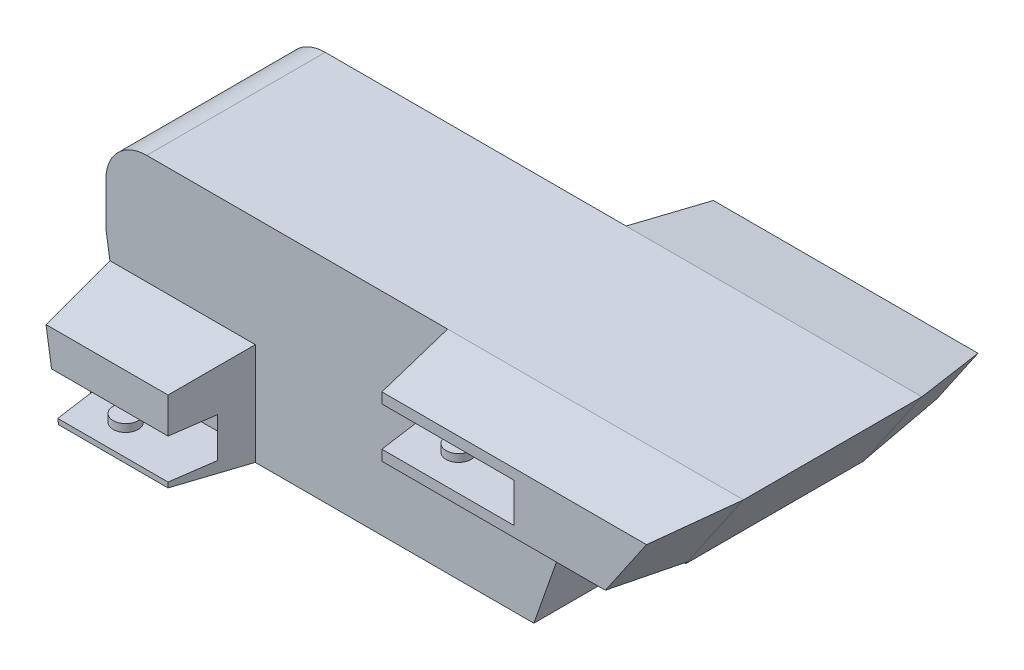
from build123d import *

# Parameters (mm, degrees)
SALIENTE_EXTRUIR1_DEPTH           = 35
SALIENTE_EXTRUIR2_DEPTH           = 15
SALIENTE_EXTRUIR2_DRAFT           = 8
SALIENTE_EXTRUIR2_PROFILE_2_DEPTH = 15
SALIENTE_EXTRUIR2_PROFILE_2_DRAFT = 8
SIMETR_A1_COPY_1_DEPTH            = 15
SIMETR_A1_COPY_1_DRAFT            = 8
SIMETR_A1_COPY_2_DEPTH            = 15
SIMETR_A1_COPY_2_DRAFT            = 8
SIMETR_A1_COPY_3_DEPTH            = 15
SIMETR_A1_COPY_3_DRAFT            = 8
CROQUIS6_W                        = 28.054373897
CROQUIS6_H                        = 7.683774959
CORTAR_EXTRUIR2_DEPTH             = 13.5
CROQUIS8_R                        = 2.45
SALIENTE_EXTRUIR3_DEPTH           = 1.5
CROQUIS9_R                        = 2.45
SALIENTE_EXTRUIR4_DEPTH           = 1.5
CROQUIS10_R                       = 2.45
SALIENTE_EXTRUIR5_DEPTH           = 1.5
SALIENTE_EXTRUIR6_START           = 1.5
CROQUIS13_R                       = 2.45
SALIENTE_EXTRUIR6_DEPTH           = 1.5


with BuildPart() as part:
    # Croquis2 → Saliente-Extruir1 (new body)
    with BuildSketch(Plane.XY):
        with BuildLine():
            Line((30.877885102, -17.110048254), (39.667083018, 7.889951746))
            Line((39.667083018, 7.889951746), (60.667083018, 7.889951746))
            Line((60.667083018, 7.889951746), (71.969737573, 24.389951746))
            Line((71.969737573, 24.389951746), (-45.030262427, 24.389951746))
            ThreePointArc((-45.030262427, 24.389951746), (-50.687116676, 22.046805996), (-53.030262427, 16.389951746))
            Line((-53.030262427, 16.389951746), (-53.030262427, 7.889951746))
            Line((-53.030262427, 7.889951746), (-49.122114898, -17.110048254))
            Line((-49.122114898, -17.110048254), (30.877885102, -17.110048254))
        make_face()
    extrude(amount=SALIENTE_EXTRUIR1_DEPTH)


with BuildPart() as saliente_extruir2_tool:
    # Croquis5 → Saliente-Extruir2 (with draft: the straight prism first)
    with BuildSketch(Plane.XY.offset(35)):
        Polygon((-49.122114898, -17.110048254), (-23.748632921, -17.110048254), (-23.748632921, 2.889951746), (-52.248632921, 2.889951746), align=None)
    extrude(amount=SALIENTE_EXTRUIR2_DEPTH)
    # Saliente-Extruir2: the draft: its side faces are tilted about the plane it starts from
    saliente_extruir2_sides = [saliente_extruir2_tool.faces().sort_by_distance(p)[0] for p in [
        (-36.435373909, -17.110048254, 42.5),
        (-23.748632921, -7.110048254, 42.5),
        (-37.998632921, 2.889951746, 42.5),
        (-50.685373909, -7.110048254, 42.5),
    ]]
    draft(saliente_extruir2_sides, Plane.XY.offset(35), SALIENTE_EXTRUIR2_DRAFT)


with BuildPart() as part_1:
    add(part.part)

    # Saliente-Extruir2: add saliente_extruir2_tool
    add(saliente_extruir2_tool.part)


with BuildPart() as saliente_extruir2_profile_2_tool:
    # Croquis5 → Saliente-Extruir2 profile 2 (with draft: the straight prism first)
    with BuildSketch(Plane.XY.offset(35)):
        Polygon((71.969737573, 24.389951746), (13.969737573, 24.389951746), (13.969737573, 8.389951746), (61.009587702, 8.389951746), align=None)
    extrude(amount=SALIENTE_EXTRUIR2_PROFILE_2_DEPTH)
    # Saliente-Extruir2 profile 2: the draft: its side faces are tilted about the plane it starts from
    saliente_extruir2_profile_2_sides = [saliente_extruir2_profile_2_tool.faces().sort_by_distance(p)[0] for p in [
        (42.969737573, 24.389951746, 42.5),
        (13.969737573, 16.389951746, 42.5),
        (37.489662638, 8.389951746, 42.5),
        (66.489662638, 16.389951746, 42.5),
    ]]
    draft(saliente_extruir2_profile_2_sides, Plane.XY.offset(35), SALIENTE_EXTRUIR2_PROFILE_2_DRAFT)


with BuildPart() as part_2:
    add(part_1.part)

    # Saliente-Extruir2 profile 2: add saliente_extruir2_profile_2_tool
    add(saliente_extruir2_profile_2_tool.part)


with BuildPart() as simetr_a1_copy_1_tool:
    # Simetría1 copy 1 sketch → Simetría1 copy 1 (with draft: the straight prism first)
    with BuildSketch(Plane(origin=(0, 0, 0), x_dir=(1, 0, 0), z_dir=(0, 0, -1))):
        Polygon((-49.122114898, 17.110048254), (-23.748632921, 17.110048254), (-23.748632921, -2.889951746), (-52.248632921, -2.889951746), align=None)
    extrude(amount=SIMETR_A1_COPY_1_DEPTH)
    # Simetría1 copy 1: the draft: its side faces are tilted about the plane it starts from
    simetr_a1_copy_1_sides = [simetr_a1_copy_1_tool.faces().sort_by_distance(p)[0] for p in [
        (-36.435373909, -17.110048254, -7.5),
        (-23.748632921, -7.110048254, -7.5),
        (-37.998632921, 2.889951746, -7.5),
        (-50.685373909, -7.110048254, -7.5),
    ]]
    draft(simetr_a1_copy_1_sides, Plane(origin=(0, 0, 0), x_dir=(1, 0, 0), z_dir=(0, 0, -1)), SIMETR_A1_COPY_1_DRAFT)


with BuildPart() as part_3:
    add(part_2.part)

    # Simetría1 copy 1: add simetr_a1_copy_1_tool
    add(simetr_a1_copy_1_tool.part)


with BuildPart() as simetr_a1_copy_2_tool:
    # Simetría1 copy 2 sketch → Simetría1 copy 2 (with draft: the straight prism first)
    with BuildSketch(Plane(origin=(0, 0, 0), x_dir=(1, 0, 0), z_dir=(0, 0, -1))):
        Polygon((71.969737573, -24.389951746), (13.969737573, -24.389951746), (13.969737573, -8.389951746), (61.009587702, -8.389951746), align=None)
    extrude(amount=SIMETR_A1_COPY_2_DEPTH)
    # Simetría1 copy 2: the draft: its side faces are tilted about the plane it starts from
    simetr_a1_copy_2_sides = [simetr_a1_copy_2_tool.faces().sort_by_distance(p)[0] for p in [
        (42.969737573, 24.389951746, -7.5),
        (13.969737573, 16.389951746, -7.5),
        (37.489662638, 8.389951746, -7.5),
        (66.489662638, 16.389951746, -7.5),
    ]]
    draft(simetr_a1_copy_2_sides, Plane(origin=(0, 0, 0), x_dir=(1, 0, 0), z_dir=(0, 0, -1)), SIMETR_A1_COPY_2_DRAFT)


with BuildPart() as part_4:
    add(part_3.part)

    # Simetría1 copy 2: add simetr_a1_copy_2_tool
    add(simetr_a1_copy_2_tool.part)


with BuildPart() as simetr_a1_copy_3_tool:
    # Simetría1 copy 3 sketch → Simetría1 copy 3 (with draft: the straight prism first)
    with BuildSketch(Plane(origin=(0, 0, 0), x_dir=(1, 0, 0), z_dir=(0, 0, -1))):
        Polygon((71.969737573, -24.389951746), (13.969737573, -24.389951746), (13.969737573, -8.389951746), (61.009587702, -8.389951746), align=None)
    extrude(amount=SIMETR_A1_COPY_3_DEPTH)
    # Simetría1 copy 3: the draft: its side faces are tilted about the plane it starts from
    simetr_a1_copy_3_sides = [simetr_a1_copy_3_tool.faces().sort_by_distance(p)[0] for p in [
        (42.969737573, 24.389951746, -7.5),
        (13.969737573, 16.389951746, -7.5),
        (37.489662638, 8.389951746, -7.5),
        (66.489662638, 16.389951746, -7.5),
    ]]
    draft(simetr_a1_copy_3_sides, Plane(origin=(0, 0, 0), x_dir=(1, 0, 0), z_dir=(0, 0, -1)), SIMETR_A1_COPY_3_DRAFT)


with BuildPart() as part_5:
    add(part_4.part)

    # Simetría1 copy 3: add simetr_a1_copy_3_tool
    add(simetr_a1_copy_3_tool.part)

    # Croquis6 → Cortar-Extruir2 (cut)
    with BuildSketch(Plane(origin=(0, 0, -15), x_dir=(-1, 0, 0), z_dir=(0, 0, -1))):
        with Locations((-27.996924522, 16.389951747)):
            Rectangle(CROQUIS6_W, CROQUIS6_H)
        Polygon((24.660477495, -6.201935733), (49.760477495, -6.201935733), (48.541135466, -14.001935733), (24.660477495, -14.001935733), align=None)
    cortar_extruir2 = extrude(amount=-CORTAR_EXTRUIR2_DEPTH, mode=Mode.SUBTRACT)

    # Simetría2: Cortar-Extruir2 across plane
    add(cortar_extruir2.mirror(Plane(origin=(0, 0, 17.5), x_dir=(1, 0, 0), z_dir=(0, 0, -1))), mode=Mode.SUBTRACT)

    # Croquis8 → Saliente-Extruir3 (add)
    with BuildSketch(Plane.XZ.offset(-20.231839226)):
        with Locations((24.182512404, 43)):
            Circle(CROQUIS8_R)
    saliente_extruir3 = extrude(amount=SALIENTE_EXTRUIR3_DEPTH)

    # Simetría3: Saliente-Extruir3 across plane
    add(saliente_extruir3.mirror(Plane(origin=(0, 0, 17.5), x_dir=(1, 0, 0), z_dir=(0, 0, -1))))

    # Croquis9 → Saliente-Extruir4 (add)
    with BuildSketch(Plane(origin=(0, 12.548064267, 0), x_dir=(1, 0, 0), z_dir=(0, 1, 0))):
        with Locations(Location((24.125726568, -43, 0), (0, 0, 180))):
            Circle(CROQUIS9_R)
    saliente_extruir4 = extrude(amount=SALIENTE_EXTRUIR4_DEPTH)

    # Simetría4: Saliente-Extruir4 across plane
    add(saliente_extruir4.mirror(Plane(origin=(0, 0, 17.5), x_dir=(1, 0, 0), z_dir=(0, 0, -1))))

    # Croquis10 → Saliente-Extruir5 (add)
    with BuildSketch(Plane.XZ.offset(6.201935733)):
        with Locations(Location((-40.160914021, 44, 0), (0, 0, 270))):
            Circle(CROQUIS10_R)
    saliente_extruir5 = extrude(amount=SALIENTE_EXTRUIR5_DEPTH)

    # Simetría5: Saliente-Extruir5 across plane
    add(saliente_extruir5.mirror(Plane(origin=(0, 0, 17.5), x_dir=(1, 0, 0), z_dir=(0, 0, -1))))

    # Croquis13 → Saliente-Extruir6 (add)
    with BuildSketch(Plane(origin=(0, -14.001935733, 0), x_dir=(1, 0, 0), z_dir=(0, 1, 0)).offset(SALIENTE_EXTRUIR6_START)):
        with Locations(Location((-40.160914021, -44, 0), (0, 0, 90))):
            Circle(CROQUIS13_R)
    saliente_extruir6 = extrude(amount=-SALIENTE_EXTRUIR6_DEPTH)

    # Simetría6: Saliente-Extruir6 across plane
    add(saliente_extruir6.mirror(Plane(origin=(0, 0, 17.5), x_dir=(1, 0, 0), z_dir=(0, 0, -1))))


solid = part_5.part
